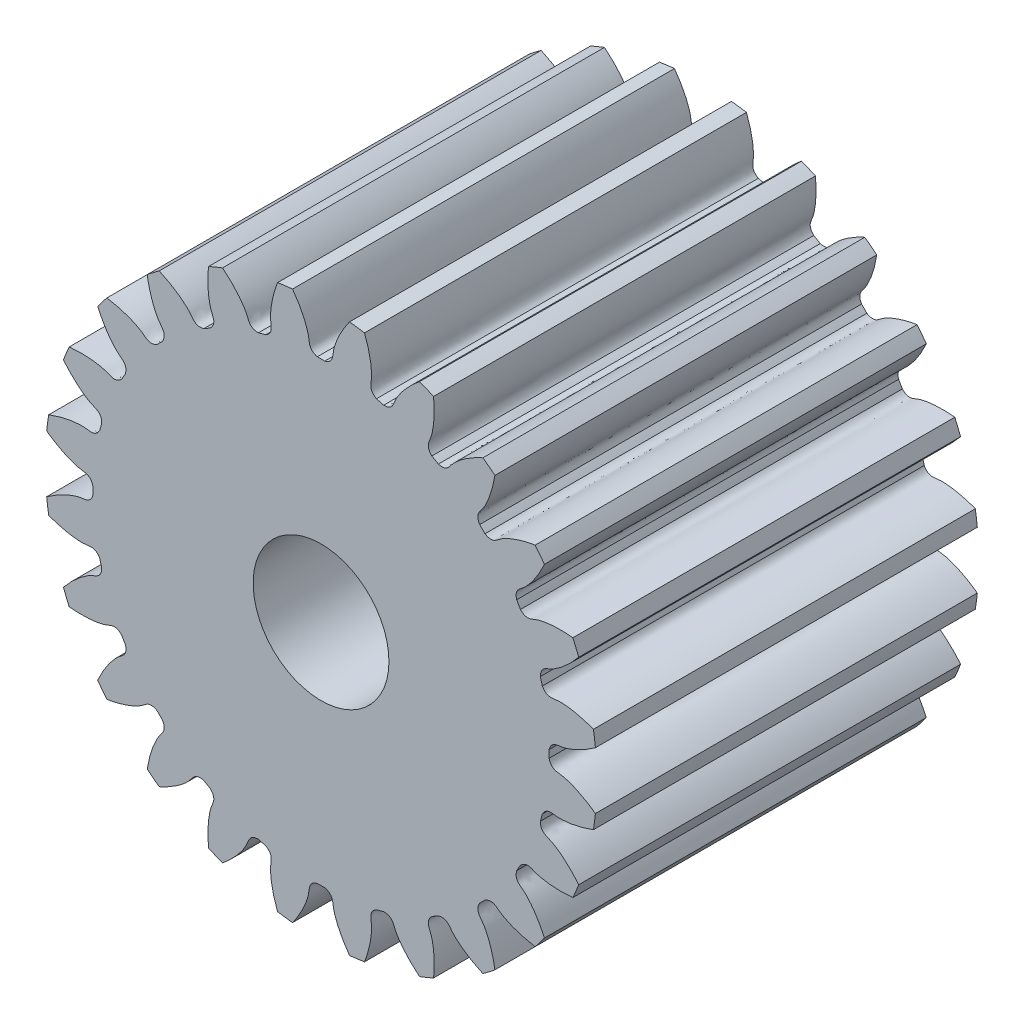
from build123d import *

# Parameters (mm, degrees)
SKETCH_1_R               = 6.5
EXTRUDE_1_DEPTH          = 9
CUT_EXTRUDE_1_DEPTH      = 13.86468033
PATTERN_CIRCULAR_1_COUNT = 24
CUT_EXTRUDE_2_REACH      = 14.83
SKETCH_4_R               = 1.6


with BuildPart() as part:
    # 草图1 → 凸台-拉伸1 (new body)
    with BuildSketch(Plane.XY):
        Circle(SKETCH_1_R)
    extrude(amount=EXTRUDE_1_DEPTH)

    # 草图2 → 切除-拉伸1 (cut, through all)
    with BuildSketch(Plane.XY):
        with BuildLine():
            ThreePointArc((0.088415956, 5.374272753), (0, 5.375), (-0.088415956, 5.374272753))
            add(Edge.make_bspline(
                [(-0.088415956, 5.374272753), (-0.283956108, 5.428430036), (-0.269523883, 5.557861799), (-0.293138588, 5.686342226), (-0.296517959, 5.702916521), (-0.300724242, 5.721620073), (-0.305840304, 5.742426358), (-0.311952817, 5.765305336), (-0.319146149, 5.790224685), (-0.327504211, 5.817149434), (-0.337109789, 5.846042111), (-0.348044663, 5.876862729), (-0.360389484, 5.909568827), (-0.374223721, 5.944115495), (-0.389625595, 5.980455405), (-0.406672011, 6.018538843), (-0.425438499, 6.058313744), (-0.445999145, 6.099725726), (-0.468426535, 6.142718129), (-0.492791687, 6.187232054), (-0.519163995, 6.233206399), (-0.547611171, 6.280577906), (-0.57819918, 6.329281201), (-0.610992189, 6.379248841), (-0.64605251, 6.430411359), (-0.68344054, 6.482697309), (-0.723214712, 6.53603332), (-0.765431443, 6.590344144), (-0.810145078, 6.645552705), (-0.857407842, 6.701580158), (-0.907269792, 6.758345935), (-0.959778768, 6.81576781), (-1.014980347, 6.873761948), (-1.0729178, 6.932242967), (-1.133632047, 6.991123994), (-1.197161611, 7.05031673), (-1.263542589, 7.109731505), (-1.332808587, 7.169277345), (-1.430211047, 7.249680778), (-1.505961903, 7.308439159), (-1.55780976, 7.347058965)],
                knots=[0, 0, 0, 0, 0.143961355, 0.149818462, 0.156576662, 0.164235955, 0.172796342, 0.182257821, 0.192620395, 0.203884061, 0.216048821, 0.229114674, 0.24308162, 0.25794966, 0.273718793, 0.290389019, 0.307960339, 0.326432751, 0.345806258, 0.366080857, 0.38725655, 0.409333336, 0.432311215, 0.456190188, 0.480970254, 0.506651413, 0.533233666, 0.560717012, 0.589101451, 0.618386984, 0.64857361, 0.679661329, 0.711650141, 0.744540047, 0.778331046, 0.813023138, 0.848616324, 0.885110603, 0.922505975, 1, 1, 1, 1], degree=3))
            ThreePointArc((-1.55780976, 7.347058965), (0, 7.510395907), (1.55780976, 7.347058965))
            add(Edge.make_bspline(
                [(0.088415956, 5.374272753), (0.283956108, 5.428430036), (0.269523883, 5.557861799), (0.293138588, 5.686342226), (0.296517959, 5.702916521), (0.300724242, 5.721620073), (0.305840304, 5.742426358), (0.311952817, 5.765305336), (0.319146149, 5.790224685), (0.327504211, 5.817149434), (0.337109789, 5.846042111), (0.348044663, 5.876862729), (0.360389484, 5.909568827), (0.374223721, 5.944115495), (0.389625595, 5.980455405), (0.406672011, 6.018538843), (0.425438499, 6.058313744), (0.445999145, 6.099725726), (0.468426535, 6.142718129), (0.492791687, 6.187232054), (0.519163995, 6.233206399), (0.547611171, 6.280577906), (0.57819918, 6.329281201), (0.610992189, 6.379248841), (0.64605251, 6.430411359), (0.68344054, 6.482697309), (0.723214712, 6.53603332), (0.765431443, 6.590344144), (0.810145078, 6.645552705), (0.857407842, 6.701580158), (0.907269792, 6.758345935), (0.959778768, 6.81576781), (1.014980347, 6.873761948), (1.0729178, 6.932242967), (1.133632047, 6.991123994), (1.197161611, 7.05031673), (1.263542589, 7.109731505), (1.332808587, 7.169277345), (1.430211047, 7.249680778), (1.505961903, 7.308439159), (1.55780976, 7.347058965)],
                knots=[0, 0, 0, 0, 0.143961355, 0.149818462, 0.156576662, 0.164235955, 0.172796342, 0.182257821, 0.192620395, 0.203884061, 0.216048821, 0.229114674, 0.24308162, 0.25794966, 0.273718793, 0.290389019, 0.307960339, 0.326432751, 0.345806258, 0.366080857, 0.38725655, 0.409333336, 0.432311215, 0.456190188, 0.480970254, 0.506651413, 0.533233666, 0.560717012, 0.589101451, 0.618386984, 0.64857361, 0.679661329, 0.711650141, 0.744540047, 0.778331046, 0.813023138, 0.848616324, 0.885110603, 0.922505975, 1, 1, 1, 1], degree=3))
        make_face()
    cut_extrude_1 = extrude(amount=CUT_EXTRUDE_1_DEPTH, mode=Mode.SUBTRACT)

    # 阵列(圆周)1: 切除-拉伸1 ×24 about axis
    pattern_circular_1_axis = Axis((0, 0, 9), (0, 0, -1))
    for i in range(1, PATTERN_CIRCULAR_1_COUNT):
        add(cut_extrude_1.rotate(pattern_circular_1_axis, i * 360 / PATTERN_CIRCULAR_1_COUNT), mode=Mode.SUBTRACT)

    # 草图4 → 切除-拉伸2 (cut, up to next)
    with BuildSketch(Plane.XY.offset(9), mode=Mode.PRIVATE) as cut_extrude_2_sk1:
        Circle(SKETCH_4_R)
    cut_extrude_2_tool1 = extrude(cut_extrude_2_sk1.sketch, amount=-CUT_EXTRUDE_2_REACH, mode=Mode.PRIVATE) & part.part
    add(cut_extrude_2_tool1.solids().sort_by_distance((0, 0, 9))[0], mode=Mode.SUBTRACT)


solid = part.part
